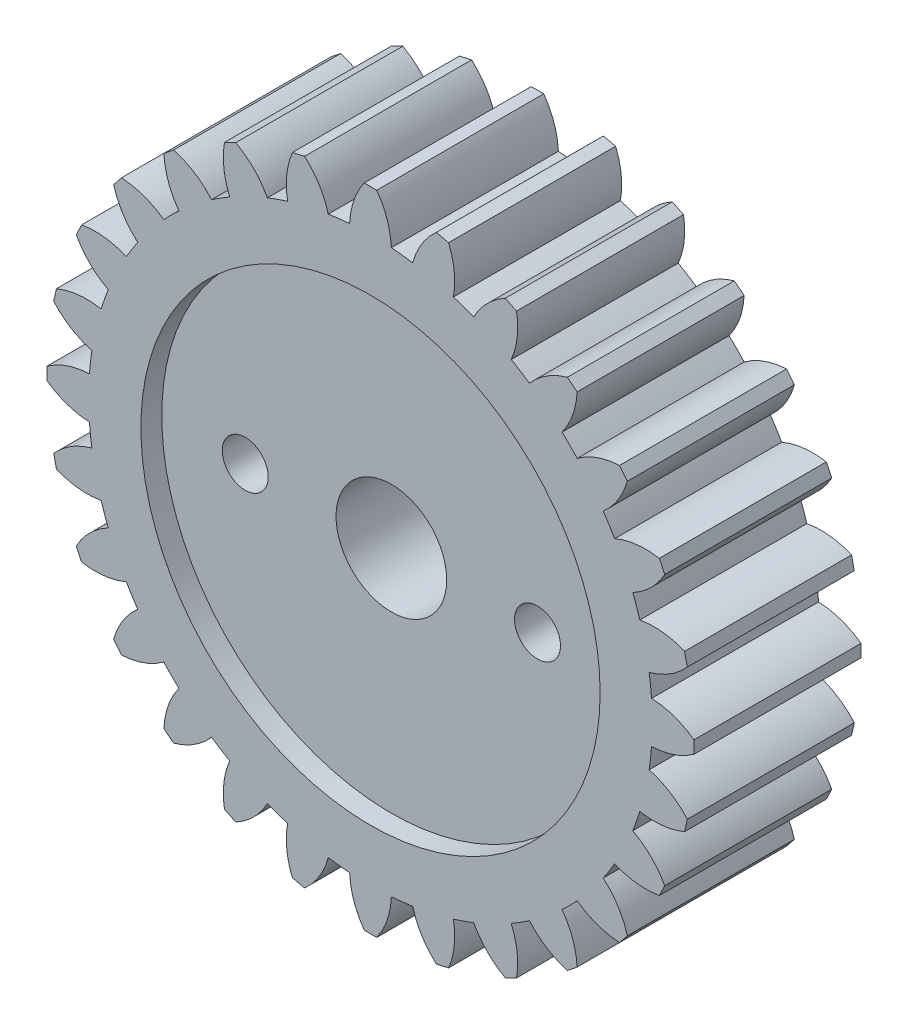
from build123d import *

# Parameters (mm, degrees)
SKETCH2_R           = 2.65
BOSS_EXTRUDE1_DEPTH = 8
BOSS_EXTRUDE2_DEPTH = 8
CIRPATTERN1_COUNT   = 28
SKETCH3_R           = 11
CUT_EXTRUDE1_DEPTH  = 1
SKETCH4_R           = 1.1
CUT_EXTRUDE2_DEPTH  = 24.010866998


with BuildPart() as part:
    # Sketch2 → Boss-Extrude1 (new body)
    with BuildSketch(Plane.XY):
        with BuildLine():
            ThreePointArc((13.5, 0), (9.893179469, 9.185586535), (1, 13.462912018))
            ThreePointArc((1, 13.462912018), (0, 13.5), (-1, 13.462912018))
            ThreePointArc((-1, 13.462912018), (-9.185586535, -9.893179469), (13.5, 0))
        make_face()
        Circle(SKETCH2_R, mode=Mode.SUBTRACT)
    extrude(amount=BOSS_EXTRUDE1_DEPTH)

    # Sketch2<3> → Boss-Extrude2 (add)
    with BuildSketch(Plane.XY):
        with BuildLine():
            ThreePointArc((1, 13.462912018), (0.799796473, 14.532930237), (0.3, 15.5))
            Line((0.3, 15.5), (-0.3, 15.5))
            ThreePointArc((-0.3, 15.5), (-0.799796473, 14.532930237), (-1, 13.462912018))
            ThreePointArc((-1, 13.462912018), (0, 13.5), (1, 13.462912018))
        make_face()
    boss_extrude2 = extrude(amount=BOSS_EXTRUDE2_DEPTH)

    # CirPattern1: Boss-Extrude2 ×28 about axis
    cirpattern1_axis = Axis((0, 0, 8), (0, 0, 1))
    for i in range(1, CIRPATTERN1_COUNT):
        add(boss_extrude2.rotate(cirpattern1_axis, i * 360 / CIRPATTERN1_COUNT))

    # Sketch3 → Cut-Extrude1 (cut)
    with BuildSketch(Plane.XY.offset(8)):
        Circle(SKETCH3_R)
    extrude(amount=-CUT_EXTRUDE1_DEPTH, mode=Mode.SUBTRACT)

    # Sketch4 → Cut-Extrude2 (cut, through all)
    with BuildSketch(Plane.XY.offset(7)):
        with Locations((-7, 0)):
            Circle(SKETCH4_R)
        with Locations((7, 0)):
            Circle(SKETCH4_R)
    extrude(amount=-CUT_EXTRUDE2_DEPTH, mode=Mode.SUBTRACT)


solid = part.part
